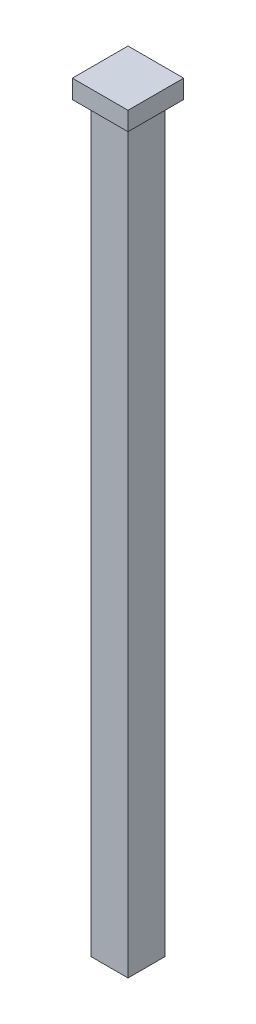
from build123d import *

# Parameters (mm, degrees)
SKETCH1_W           = 150
SKETCH1_H           = 150
BOSS_EXTRUDE1_DEPTH = 50
SKETCH2_W           = 100
SKETCH2_H           = 100
BOSS_EXTRUDE2_DEPTH = 2000
SKETCH3_R           = 25
CUT_EXTRUDE1_DEPTH  = 25


with BuildPart() as part:
    # Sketch1 → Boss-Extrude1 (new body)
    with BuildSketch(Plane(origin=(0, 0, 0), x_dir=(1, 0, 0), z_dir=(0, 1, 0))):
        Rectangle(SKETCH1_W, SKETCH1_H)
    extrude(amount=BOSS_EXTRUDE1_DEPTH)

    # Sketch2 → Boss-Extrude2 (add)
    with BuildSketch(Plane.XZ):
        Rectangle(SKETCH2_W, SKETCH2_H)
    extrude(amount=BOSS_EXTRUDE2_DEPTH)

    # Sketch3 → Cut-Extrude1 (cut)
    with BuildSketch(Plane.XZ.offset(2000)):
        Circle(SKETCH3_R)
    extrude(amount=-CUT_EXTRUDE1_DEPTH, mode=Mode.SUBTRACT)


solid = part.part
